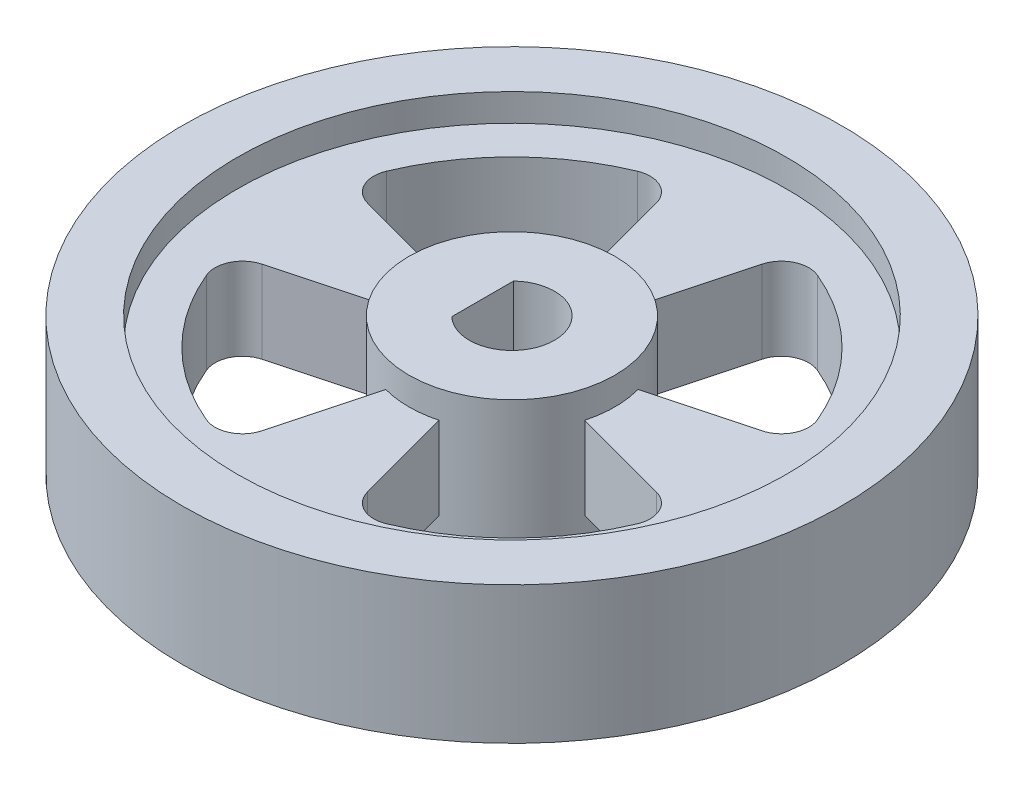
from build123d import *

# Parameters (mm, degrees)
EXTRUDE_1_DEPTH        = 5
EXTRUDE_1_DEPTH_BACK   = 5
SKETCH_1_R             = 24
SKETCH_1_R_2           = 20
EXTRUDE_1_2_DEPTH      = 5
EXTRUDE_1_2_DEPTH_BACK = 5
SKETCH_1_R_3           = 7.5
EXTRUDE_2_DEPTH        = 3
EXTRUDE_2_DEPTH_BACK   = 3
SKETCH_1_4_R           = 20
SKETCH_1_4_R_2         = 7.5
CUT_EXTRUDE_2_DEPTH    = 6


with BuildPart() as part:
    # 草图1 → 凸台-拉伸1 (new, two sides: drawn at the far end of the back side and taken through both)
    with BuildSketch(Plane(origin=(0, 0, 0), x_dir=(1, 0, 0), z_dir=(0, 1, 0)).offset(-EXTRUDE_1_DEPTH_BACK)):
        Circle(SKETCH_1_R)
        Circle(SKETCH_1_R_2, mode=Mode.SUBTRACT)
    extrude(amount=EXTRUDE_1_DEPTH + EXTRUDE_1_DEPTH_BACK)



with BuildPart() as body_2:
    # 草图1 → Extrude 1 2 (new, two sides: drawn at the far end of the back side and taken through both)
    with BuildSketch(Plane(origin=(0, 0, 0), x_dir=(1, 0, 0), z_dir=(0, 1, 0)).offset(-EXTRUDE_1_2_DEPTH_BACK)):
        Circle(SKETCH_1_R_3)
        with BuildLine():
            Line((-2.132486811, -2.25), (-2.132486811, 2.25))
            ThreePointArc((-2.132486811, 2.25), (3.1, 0), (-2.132486811, -2.25))
        make_face(mode=Mode.SUBTRACT)
    extrude(amount=EXTRUDE_1_2_DEPTH + EXTRUDE_1_2_DEPTH_BACK)


with BuildPart() as part_1:
    add(part.part)

    add(body_2.part)  # 凸台-拉伸2 merges body 2
    # 草图1<4> → 凸台-拉伸2 (add, two sides: drawn at the far end of the back side and taken through both)
    with BuildSketch(Plane(origin=(0, 0, 0), x_dir=(1, 0, 0), z_dir=(0, 1, 0)).offset(-EXTRUDE_2_DEPTH_BACK)):
        Circle(SKETCH_1_4_R)
        Circle(SKETCH_1_4_R_2, mode=Mode.SUBTRACT)
    extrude(amount=EXTRUDE_2_DEPTH + EXTRUDE_2_DEPTH_BACK)

    # 草图3 → 切除-拉伸2 (cut)
    with BuildSketch(Plane(origin=(0, 3, 0), x_dir=(1, 0, 0), z_dir=(0, 1, 0))):
        with BuildLine():
            Line((3.847621718, 14.359519738), (1.941142838, 7.244443697))
            ThreePointArc((1.941142838, 7.244443697), (5.303300859, 5.303300859), (7.244443697, 1.941142838))
            Line((7.244443697, 1.941142838), (14.359519738, 3.847621718))
            ThreePointArc((14.359519738, 3.847621718), (15.636877848, 4.897436726), (15.687465868, 6.55006982))
            ThreePointArc((15.687465868, 6.55006982), (12.02081528, 12.02081528), (6.55006982, 15.687465868))
            ThreePointArc((6.55006982, 15.687465868), (4.897436726, 15.636877848), (3.847621718, 14.359519738))
        make_face()
        with BuildLine():
            ThreePointArc((7.244443697, -1.941142838), (5.303300859, -5.303300859), (1.941142838, -7.244443697))
            Line((1.941142838, -7.244443697), (3.847621718, -14.359519738))
            ThreePointArc((3.847621718, -14.359519738), (4.897436726, -15.636877848), (6.55006982, -15.687465868))
            ThreePointArc((6.55006982, -15.687465868), (12.02081528, -12.02081528), (15.687465868, -6.55006982))
            ThreePointArc((15.687465868, -6.55006982), (15.636877848, -4.897436726), (14.359519738, -3.847621718))
            Line((14.359519738, -3.847621718), (7.244443697, -1.941142838))
        make_face()
        with BuildLine():
            ThreePointArc((-1.941142838, -7.244443697), (-5.303300859, -5.303300859), (-7.244443697, -1.941142838))
            Line((-7.244443697, -1.941142838), (-14.359519738, -3.847621718))
            ThreePointArc((-14.359519738, -3.847621718), (-15.636877848, -4.897436726), (-15.687465868, -6.55006982))
            ThreePointArc((-15.687465868, -6.55006982), (-12.02081528, -12.02081528), (-6.55006982, -15.687465868))
            ThreePointArc((-6.55006982, -15.687465868), (-4.897436726, -15.636877848), (-3.847621718, -14.359519738))
            Line((-3.847621718, -14.359519738), (-1.941142838, -7.244443697))
        make_face()
        with BuildLine():
            ThreePointArc((-7.244443697, 1.941142838), (-5.303300859, 5.303300859), (-1.941142838, 7.244443697))
            Line((-1.941142838, 7.244443697), (-3.847621718, 14.359519738))
            ThreePointArc((-3.847621718, 14.359519738), (-4.897436726, 15.636877848), (-6.55006982, 15.687465868))
            ThreePointArc((-6.55006982, 15.687465868), (-12.02081528, 12.02081528), (-15.687465868, 6.55006982))
            ThreePointArc((-15.687465868, 6.55006982), (-15.636877848, 4.897436726), (-14.359519738, 3.847621718))
            Line((-14.359519738, 3.847621718), (-7.244443697, 1.941142838))
        make_face()
    extrude(amount=-CUT_EXTRUDE_2_DEPTH, mode=Mode.SUBTRACT)


solid = part_1.part
